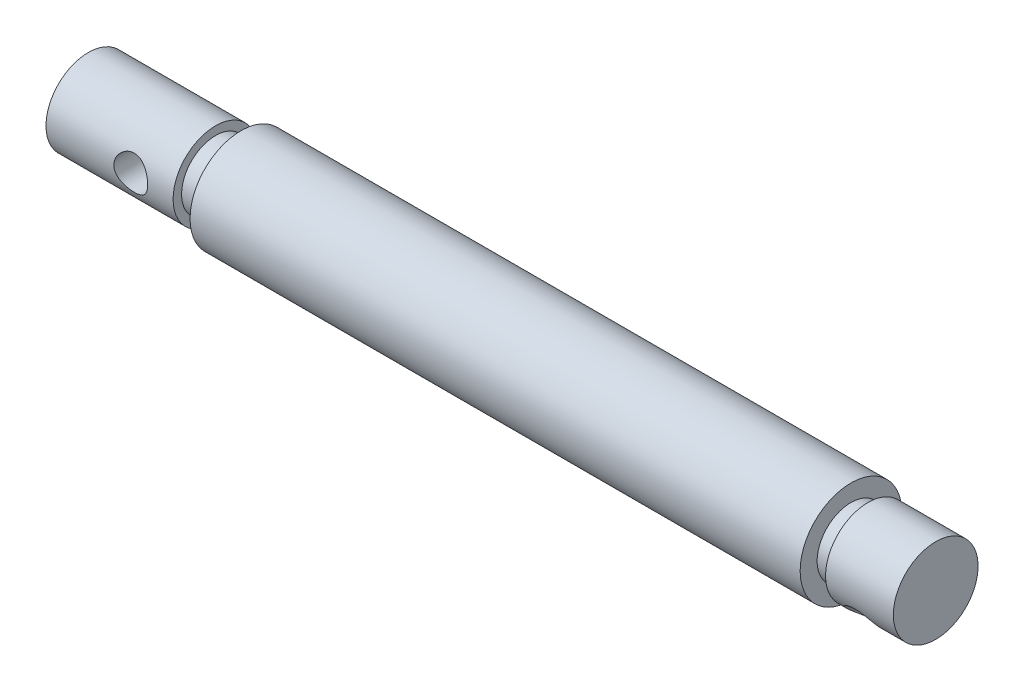
from build123d import *

# Parameters (mm, degrees)
CUT_EXTRUDE_1_DEPTH      = 101.359354322
CUT_EXTRUDE_1_DEPTH_BACK = 101.359354322
SKETCH_2_R               = 2


with BuildPart() as part:
    # 草图1 → 旋转1 (revolve)
    with BuildSketch(Plane.XY, mode=Mode.PRIVATE) as revolve_1_sk:
        Polygon((0, 0), (0, 5), (15, 5), (15, 4), (18, 4), (18, 6), (90, 6), (90, 4), (92, 4), (92, 5), (100, 5), (100, 0), align=None)
    revolve(revolve_1_sk.sketch.rotate(Axis((0, 0, 0), (1, 0, 0)), 90), axis=Axis((0, 0, 0), (1, 0, 0)))

    # 草图2 → 切除-拉伸1 (cut, two sides: drawn at the far end of the back side and taken through both)
    with BuildSketch(Plane.XY.offset(-CUT_EXTRUDE_1_DEPTH_BACK)):
        with Locations((10, 0)):
            Circle(SKETCH_2_R)
    extrude(amount=CUT_EXTRUDE_1_DEPTH + CUT_EXTRUDE_1_DEPTH_BACK, mode=Mode.SUBTRACT)

    # 草图4 → 切除-旋转1 (revolve, cut)
    with BuildSketch(Plane(origin=(95, 0, 0), x_dir=(0, 0, -1), z_dir=(1, 0, 0))):
        Polygon((-2.121320344, -2.121320344), (-2.121320344, -4.949747468), (-3.535533906, -3.535533906), align=None)
    revolve(axis=Axis((95, 0, 0), (0, -0.7071067811865489, 0.7071067811865462)), mode=Mode.SUBTRACT)


solid = part.part
